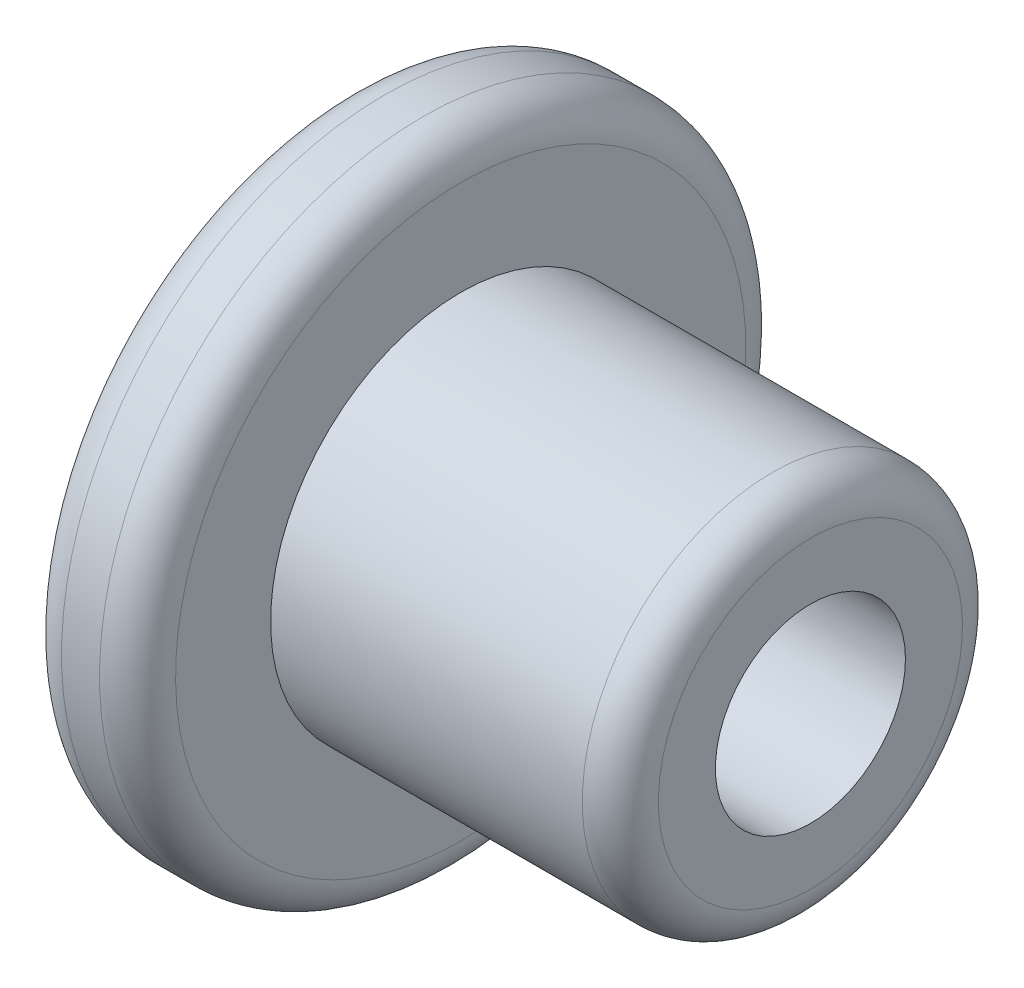
from build123d import *

# Parameters (mm, degrees)
SKETCH_1_W             = 1.5
SKETCH_1_H             = 4.25
SKETCH_1_W_2           = 4.6
SKETCH_1_H_2           = 2.5
FILLET_1_R             = 0.5
HOLE_WIZARD_M3_1_D     = 2.5
HOLE_WIZARD_M3_1_DEPTH = 4
HOLE_WIZARD_M3_1_TIP   = 0.751075774


with BuildPart() as part:
    # 草图1 → 旋转1 (revolve)
    with BuildSketch(Plane.XY):
        with Locations((-0.75, 2.125)):
            Rectangle(SKETCH_1_W, SKETCH_1_H)
        with Locations((2.3, 1.25)):
            Rectangle(SKETCH_1_W_2, SKETCH_1_H_2)
    revolve(axis=Axis((0, 0, 0), (-1, 0, 0)))

    # 圆角1
    fillet_1_edges = [part.edges().sort_by_distance(p)[0] for p in [
        (4.6, -2.5, 0),
        (-1.5, -4.25, 0),
        (0, -4.25, 0),
    ]]
    fillet(fillet_1_edges, radius=FILLET_1_R)

    # M3 螺纹孔1
    with Locations(Plane(origin=(4.6, 0, 0), x_dir=(0, 0, -1), z_dir=(1, 0, 0))):
        with Locations((0, 0)):
            Hole(HOLE_WIZARD_M3_1_D / 2, depth=HOLE_WIZARD_M3_1_DEPTH)
            with Locations((0, 0, -(HOLE_WIZARD_M3_1_DEPTH + HOLE_WIZARD_M3_1_TIP / 2))):  # 118° drill point
                Cone(0, HOLE_WIZARD_M3_1_D / 2, HOLE_WIZARD_M3_1_TIP, mode=Mode.SUBTRACT)


solid = part.part
